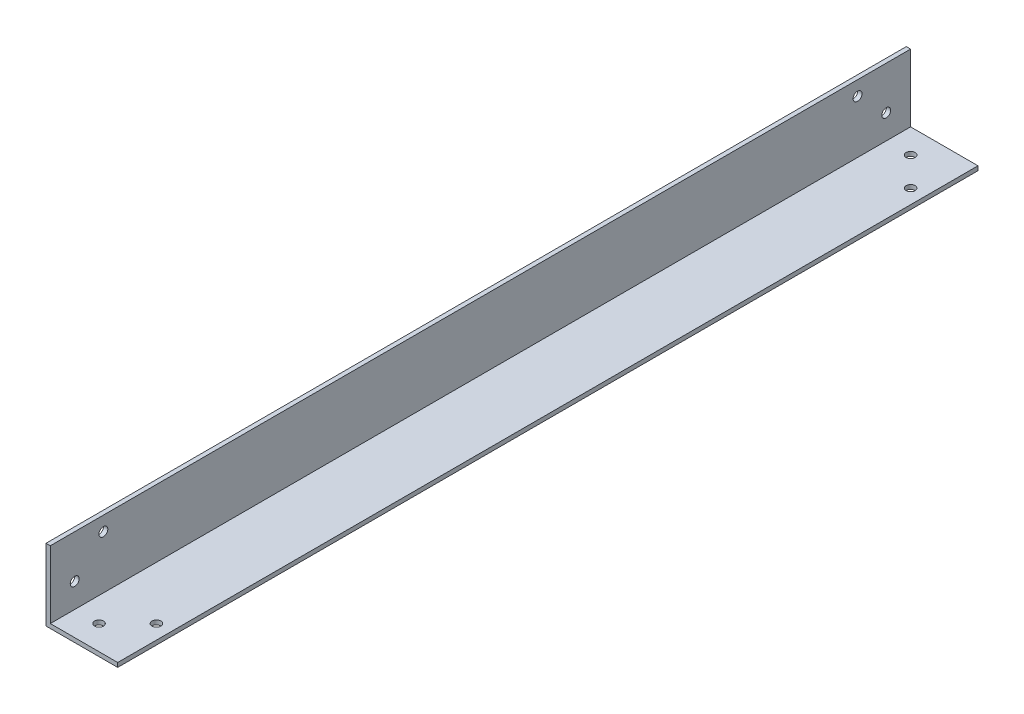
from build123d import *

# Parameters (mm, degrees)
BOSS_EXTRUDE1_DEPTH = 300
SKETCH2_R           = 1.55
CUT_EXTRUDE1_DEPTH  = 10
SKETCH3_R           = 1.55
CUT_EXTRUDE2_DEPTH  = 10


with BuildPart() as part:
    # Sketch1 → Boss-Extrude1 (new body)
    with BuildSketch(Plane.XY):
        Polygon((0, 0), (0, 25), (1.5, 25), (1.5, 1.5), (25, 1.5), (25, 0), align=None)
    extrude(amount=BOSS_EXTRUDE1_DEPTH)

    # Sketch2 → Cut-Extrude1 (cut)
    with BuildSketch(Plane.ZY):
        with Locations((281.5, 20)):
            Circle(SKETCH2_R)
        with Locations((291.5, 10)):
            Circle(SKETCH2_R)
        with Locations((18.5, 20)):
            Circle(SKETCH2_R)
        with Locations((8.5, 10)):
            Circle(SKETCH2_R)
    extrude(amount=-CUT_EXTRUDE1_DEPTH, mode=Mode.SUBTRACT)

    # Sketch3 → Cut-Extrude2 (cut)
    with BuildSketch(Plane.XZ):
        with Locations((19.999999996, 281.5)):
            Circle(SKETCH3_R)
        with Locations((9.999999998, 291.5)):
            Circle(SKETCH3_R)
        with Locations((19.999999996, 18.5)):
            Circle(SKETCH3_R)
        with Locations((9.999999998, 8.5)):
            Circle(SKETCH3_R)
    extrude(amount=-CUT_EXTRUDE2_DEPTH, mode=Mode.SUBTRACT)


solid = part.part
